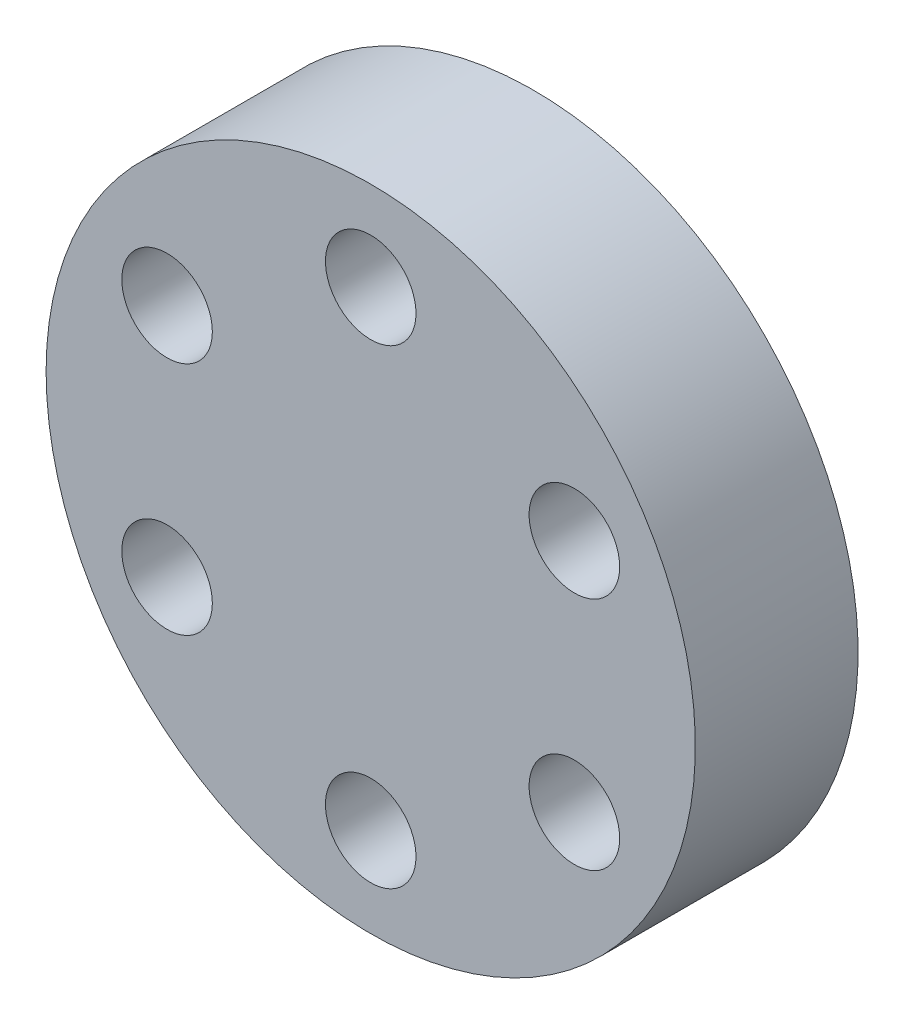
from build123d import *

# Parameters (mm, degrees)
SKETCH1_R            = 19
BOSS_EXTRUDE1_DEPTH  = 9.525
M5_CLEARANCE_HOLE1_D = 5.3


with BuildPart() as part:
    # Sketch1 → Boss-Extrude1 (new body)
    with BuildSketch(Plane.XY):
        with Locations(Location((0, 0, 0), (0, 0, 180))):
            Circle(SKETCH1_R)
    extrude(amount=BOSS_EXTRUDE1_DEPTH)

    # M5 Clearance Hole1 (through all)
    with Locations(Plane.XY.offset(9.525)):
        with Locations((-11.919791467, 6.881894812), (0, 13.763789624), (11.919791467, 6.881894812), (11.919791467, -6.881894812), (0, -13.763789624), (-11.919791467, -6.881894812)):
            Hole(M5_CLEARANCE_HOLE1_D / 2)


solid = part.part
